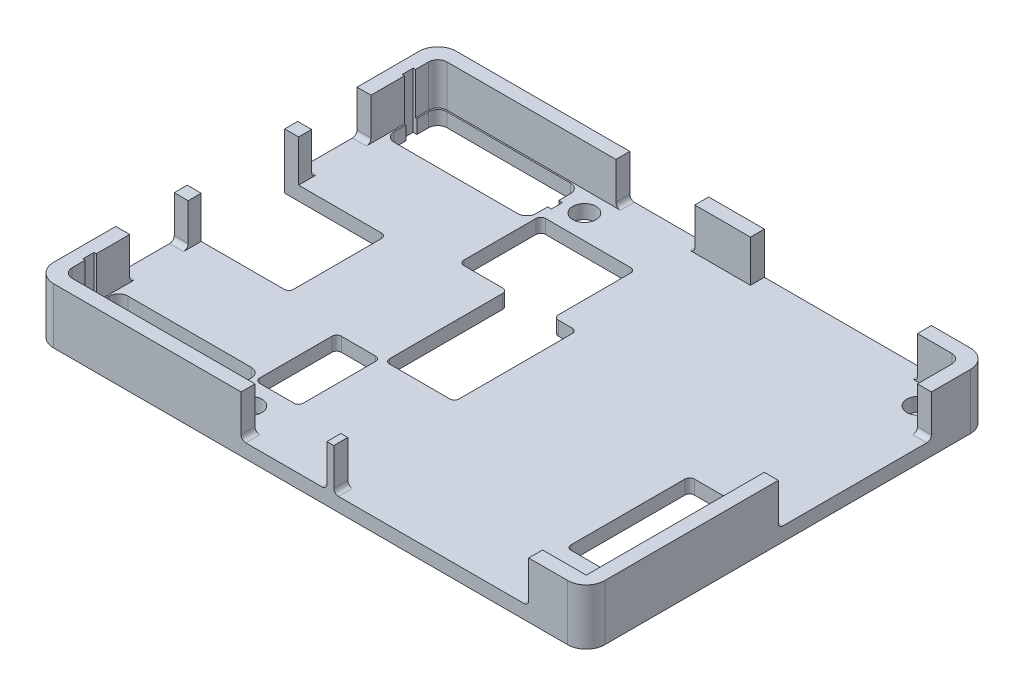
from build123d import *

# Parameters (mm, degrees)
SKETCH_1_W               = 59.4
SKETCH_1_H               = 43.4
EXTRUDE_1_DEPTH          = 6
SKETCH_2_W               = 56.4
SKETCH_2_H               = 40.4
CUT_EXTRUDE_1_DEPTH      = 4.5
SKETCH_3_R               = 1.25
CUT_EXTRUDE_2_DEPTH      = 38.057118075
CUT_EXTRUDE_3_DEPTH      = 38.057118075
CUT_EXTRUDE_3_DEPTH_BACK = 38.057118075
SKETCH_4_W               = 10.95
SKETCH_4_H               = 10.5
SKETCH_5_W               = 6.4
SKETCH_5_H               = 4.5
SKETCH_5_W_2             = 6.3
CUT_EXTRUDE_4_DEPTH      = 4.5
CUT_EXTRUDE_5_DEPTH      = 38.057118075
CUT_EXTRUDE_5_DEPTH_BACK = 38.057118075
CUT_EXTRUDE_6_DEPTH      = 38.057118075
CUT_EXTRUDE_6_DEPTH_BACK = 38.057118075
SKETCH_9_W               = 10.2
SKETCH_9_H               = 8.8
SKETCH_9_W_2             = 4.7
CUT_EXTRUDE_7_DEPTH      = 38.057118075
CUT_EXTRUDE_7_DEPTH_BACK = 38.057118075
SKETCH_10_W              = 8
SKETCH_10_H              = 13.3
FILLET_1_R               = 2
SKETCH_11_W              = 8.5
SKETCH_11_H              = 4.5
SKETCH_11_W_2            = 18
CUT_EXTRUDE_8_DEPTH      = 3
SKETCH_12_W              = 9.25
SKETCH_12_H              = 4.5
SKETCH_12_W_2            = 21
CUT_EXTRUDE_9_DEPTH      = 3
SKETCH_13_W              = 16.5
SKETCH_13_H              = 4.5
CUT_EXTRUDE_10_DEPTH     = 3
SKETCH_14_W              = 7.5
SKETCH_14_H              = 13.2
CUT_EXTRUDE_11_DEPTH     = 10
FILLET_2_R               = 0.5
FILLET_3_R               = 1
FILLET_4_R               = 0.5


with BuildPart() as part:
    # 草图1 → 凸台-拉伸1 (new body)
    with BuildSketch(Plane(origin=(0, 0, 0), x_dir=(1, 0, 0), z_dir=(0, 1, 0))):
        Rectangle(SKETCH_1_W, SKETCH_1_H)
    extrude(amount=EXTRUDE_1_DEPTH)

    # 草图2 → 切除-拉伸1 (cut)
    with BuildSketch(Plane(origin=(0, 6, 0), x_dir=(1, 0, 0), z_dir=(0, 1, 0))):
        Rectangle(SKETCH_2_W, SKETCH_2_H)
    extrude(amount=-CUT_EXTRUDE_1_DEPTH, mode=Mode.SUBTRACT)

    # 草图3 → 切除-拉伸2 (cut, through all)
    with BuildSketch(Plane(origin=(0, 1.5, 0), x_dir=(1, 0, 0), z_dir=(0, 1, 0))):
        with Locations((-10.2, -18)):
            Circle(SKETCH_3_R)
        with Locations((-10.2, 18)):
            Circle(SKETCH_3_R)
        with Locations((25.8, 18)):
            Circle(SKETCH_3_R)
        with Locations((25.8, -18)):
            Circle(SKETCH_3_R)
    extrude(amount=-CUT_EXTRUDE_2_DEPTH, mode=Mode.SUBTRACT)

    # 草图4 → 切除-拉伸3 (cut, two sides: drawn at the far end of the back side and taken through both)
    with BuildSketch(Plane(origin=(0, 1.5, 0), x_dir=(1, 0, 0), z_dir=(0, 1, 0)).offset(-CUT_EXTRUDE_3_DEPTH_BACK)):
        with Locations((-24.225, -0.05)):
            Rectangle(SKETCH_4_W, SKETCH_4_H)
    extrude(amount=CUT_EXTRUDE_3_DEPTH + CUT_EXTRUDE_3_DEPTH_BACK, mode=Mode.SUBTRACT)

    # 草图5 → 切除-拉伸4 (cut)
    with BuildSketch(Plane.ZY.offset(29.7)):
        with Locations((-9.8, 3.75)):
            Rectangle(SKETCH_5_W, SKETCH_5_H)
        with Locations((9.85, 3.75)):
            Rectangle(SKETCH_5_W_2, SKETCH_5_H)
    extrude(amount=-CUT_EXTRUDE_4_DEPTH, mode=Mode.SUBTRACT)

    # 草图8 → 切除-拉伸5 (cut, two sides: drawn at the far end of the back side and taken through both)
    with BuildSketch(Plane(origin=(0, 1.5, 0), x_dir=(1, 0, 0), z_dir=(0, 1, 0)).offset(-CUT_EXTRUDE_5_DEPTH_BACK)):
        Polygon((-28.05, 14.35), (-28.05, 16.6), (-28.45, 16.6), (-28.45, 17.8), (-28.05, 17.8), (-28.05, 20.05), (-12.75, 20.05), (-12.75, 17.8), (-12.35, 17.8), (-12.35, 16.6), (-12.75, 16.6), (-12.75, 14.35), align=None)
        Polygon((-28.05, -20.05), (-12.75, -20.05), (-12.75, -17.8), (-12.35, -17.8), (-12.35, -16.6), (-12.75, -16.6), (-12.75, -14.35), (-28.05, -14.35), (-28.05, -16.6), (-28.45, -16.6), (-28.45, -17.8), (-28.05, -17.8), align=None)
    extrude(amount=CUT_EXTRUDE_5_DEPTH + CUT_EXTRUDE_5_DEPTH_BACK, mode=Mode.SUBTRACT)

    # 草图9 → 切除-拉伸6 (cut, two sides: drawn at the far end of the back side and taken through both)
    with BuildSketch(Plane(origin=(0, 1.5, 0), x_dir=(1, 0, 0), z_dir=(0, 1, 0)).offset(-CUT_EXTRUDE_6_DEPTH_BACK)):
        with Locations((-7.2, 11)):
            Rectangle(SKETCH_9_W, SKETCH_9_H)
        with Locations((-9.95, -11)):
            Rectangle(SKETCH_9_W_2, SKETCH_9_H)
    extrude(amount=CUT_EXTRUDE_6_DEPTH + CUT_EXTRUDE_6_DEPTH_BACK, mode=Mode.SUBTRACT)

    # 草图10 → 切除-拉伸7 (cut, two sides: drawn at the far end of the back side and taken through both)
    with BuildSketch(Plane(origin=(0, 1.5, 0), x_dir=(1, 0, 0), z_dir=(0, 1, 0)).offset(-CUT_EXTRUDE_7_DEPTH_BACK)):
        with Locations((24.05, -7.55)):
            Rectangle(SKETCH_10_W, SKETCH_10_H)
    extrude(amount=CUT_EXTRUDE_7_DEPTH + CUT_EXTRUDE_7_DEPTH_BACK, mode=Mode.SUBTRACT)

    # 圆角1
    fillet_1_edges = [part.edges().sort_by_distance(p)[0] for p in [
        (29.7, 3, 21.7),
        (-29.7, 3, 21.7),
        (-29.7, 3, -21.7),
        (29.7, 3, -21.7),
    ]]
    fillet(fillet_1_edges, radius=FILLET_1_R)

    # 草图11 → 切除-拉伸8 (cut)
    with BuildSketch(Plane(origin=(0, 0, -21.7), x_dir=(-1, 0, 0), z_dir=(0, 0, -1))):
        with Locations((4.75, 3.75)):
            Rectangle(SKETCH_11_W, SKETCH_11_H)
        with Locations((-14.5, 3.75)):
            Rectangle(SKETCH_11_W_2, SKETCH_11_H)
    extrude(amount=-CUT_EXTRUDE_8_DEPTH, mode=Mode.SUBTRACT)

    # 草图12 → 切除-拉伸9 (cut)
    with BuildSketch(Plane.XY.offset(21.7)):
        with Locations((-2.875, 3.75)):
            Rectangle(SKETCH_12_W, SKETCH_12_H)
        with Locations((13, 3.75)):
            Rectangle(SKETCH_12_W_2, SKETCH_12_H)
    extrude(amount=-CUT_EXTRUDE_9_DEPTH, mode=Mode.SUBTRACT)

    # 草图13 → 切除-拉伸10 (cut)
    with BuildSketch(Plane(origin=(29.7, 0, 0), x_dir=(0, 0, -1), z_dir=(1, 0, 0))):
        with Locations((7.25, 3.75)):
            Rectangle(SKETCH_13_W, SKETCH_13_H)
    extrude(amount=-CUT_EXTRUDE_10_DEPTH, mode=Mode.SUBTRACT)

    # 草图14 → 切除-拉伸11 (cut)
    with BuildSketch(Plane.XZ):
        with Locations((-3.35, 0)):
            Rectangle(SKETCH_14_W, SKETCH_14_H)
    extrude(amount=-CUT_EXTRUDE_11_DEPTH, mode=Mode.SUBTRACT)

    # 圆角2
    fillet_2_edges = [part.edges().sort_by_distance(p)[0] for p in [
        (-12.3, 0.75, 6.6),
        (-2.1, 0.75, -15.4),
        (-18.75, 0.75, -5.2),
        (-7.6, 0.75, 6.6),
        (28.05, 0.75, 0.9),
        (-12.3, 0.75, -6.6),
        (20.05, 0.75, 14.2),
        (-18.75, 0.75, 5.3),
        (-7.6, 0.75, 15.4),
        (28.05, 0.75, 14.2),
        (20.05, 0.75, 0.9),
        (-12.3, 0.75, -15.4),
        (-12.3, 0.75, 15.4),
        (-7.1, 0.75, 6.6),
        (-7.1, 0.75, -6.6),
        (0.4, 0.75, 6.6),
        (0.4, 0.75, -6.6),
        (-2.1, 0.75, -6.6),
    ]]
    fillet(fillet_2_edges, radius=FILLET_2_R)

    # 圆角3
    fillet_3_edges = [part.edges().sort_by_distance(p)[0] for p in [
        (-28.05, 0.75, 14.35),
        (-28.05, 0.75, -20.05),
        (-28.2, 3.75, -20.2),
        (-12.75, 0.75, -14.35),
        (-12.75, 0.75, 20.05),
        (-28.05, 0.75, -14.35),
        (-28.05, 0.75, 20.05),
        (-28.2, 3.75, 20.2),
        (-12.75, 0.75, 14.35),
        (-12.75, 0.75, -20.05),
        (28.2, 3.75, -20.2),
    ]]
    fillet(fillet_3_edges, radius=FILLET_3_R)

    # 圆角4
    fillet_4_edges = [part.edges().sort_by_distance(p)[0] for p in [
        (-28.95, 1.5, -13),
        (-28.95, 1.5, 6.7),
        (-28.95, 1.5, -6.6),
        (-28.95, 1.5, 13),
        (28.95, 1.5, 1),
        (2.5, 1.5, 20.95),
        (-7.5, 1.5, 20.95),
        (-9, 1.5, -20.95),
        (28.95, 1.5, -15.5),
        (-0.5, 1.5, -20.95),
        (23.5, 1.5, -20.95),
        (23.5, 1.5, 20.95),
        (1.75, 1.5, 20.95),
    ]]
    fillet(fillet_4_edges, radius=FILLET_4_R)


solid = part.part
